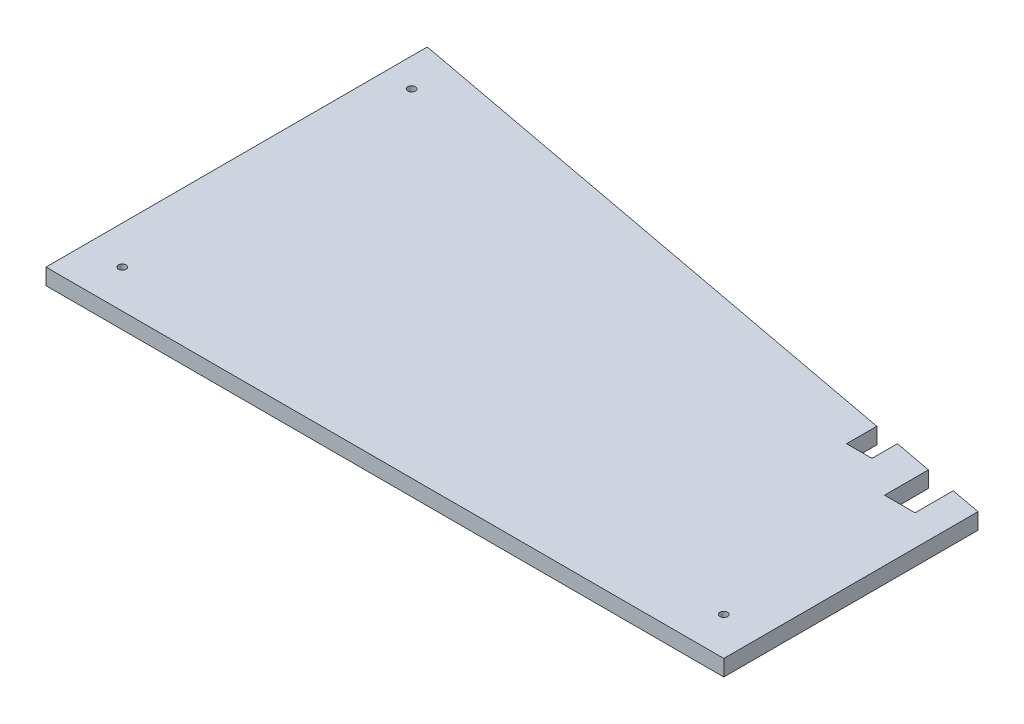
from build123d import *

# Parameters (mm, degrees)
SKETCH2_R           = 1.5
BOSS_EXTRUDE1_DEPTH = 6.35


with BuildPart() as part:
    # Sketch2 → Boss-Extrude1 (new body)
    with BuildSketch(Plane(origin=(0, 0, 0), x_dir=(1, 0, 0), z_dir=(0, 1, 0))):
        Polygon((0, 0), (266.65, 0), (266.65, 100), (254.65, 102.250140634), (254.65, 87.250140634), (242.650050871, 87.215199066), (242.650050871, 104.500271729), (227.650050871, 107.312947521), (227.650050871, 97.312947521), (217.650050871, 97.283829424), (217.650050871, 109.188064716), (0, 150), align=None)
        with Locations(Location((15, 15, 0), (0, 0, 270))):
            Circle(SKETCH2_R, mode=Mode.SUBTRACT)
        with Locations(Location((251.65, 15, 0), (0, 0, 270))):
            Circle(SKETCH2_R, mode=Mode.SUBTRACT)
        with Locations(Location((11.196927717, 132.639018124, 0), (0, 0, 270))):
            Circle(SKETCH2_R, mode=Mode.SUBTRACT)
    extrude(amount=BOSS_EXTRUDE1_DEPTH)


solid = part.part
